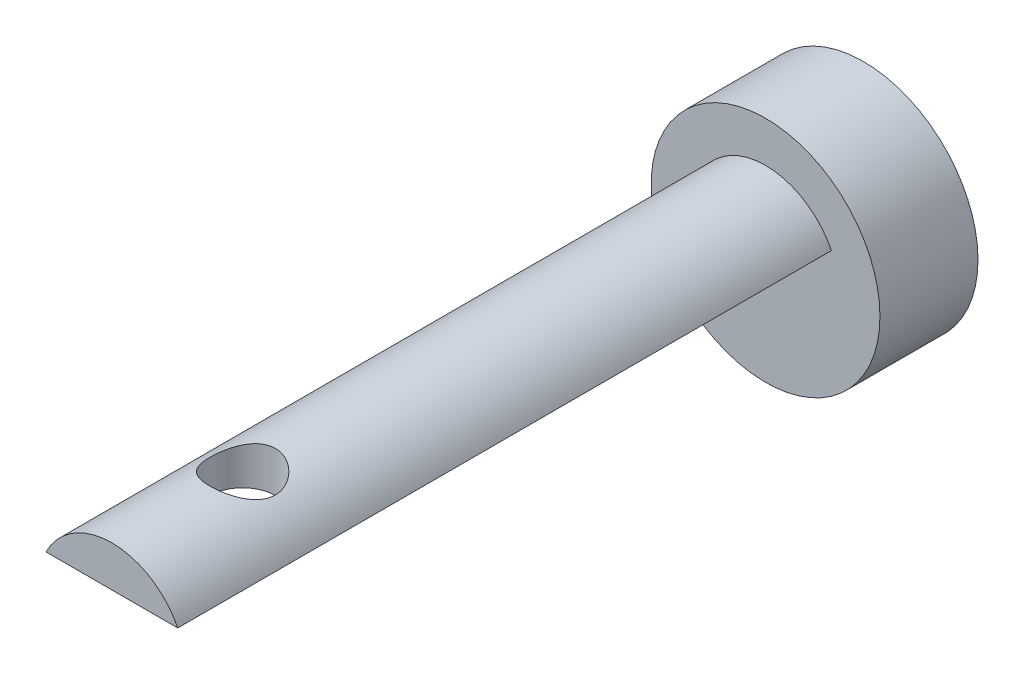
from build123d import *

# Parameters (mm, degrees)
BOSS_EXTRUDE1_DEPTH = 3
BOSS_EXTRUDE2_DEPTH = 20
SKETCH3_R           = 1
CUT_EXTRUDE1_DEPTH  = 10


with BuildPart() as part:
    # Sketch1 → Boss-Extrude1 (new body)
    with BuildSketch(Plane.XY):
        with BuildLine():
            ThreePointArc((3.354101966, 1), (0, 3.5), (-3.354101966, 1))
            Line((-3.354101966, 1), (3.354101966, 1))
        make_face()
        with BuildLine():
            Line((3.354101966, 1), (-3.354101966, 1))
            ThreePointArc((-3.354101966, 1), (-0.505293538, -3.463333429), (3.5, 0))
            ThreePointArc((3.5, 0), (3.463333429, 0.505293538), (3.354101966, 1))
        make_face()
    extrude(amount=BOSS_EXTRUDE1_DEPTH)

    # Sketch2 → Boss-Extrude2 (add)
    with BuildSketch(Plane.XY.offset(3)):
        with BuildLine():
            ThreePointArc((2.015564437, 1), (0, 2.25), (-2.015564437, 1))
            Line((-2.015564437, 1), (2.015564437, 1))
        make_face()
    extrude(amount=BOSS_EXTRUDE2_DEPTH)

    # Sketch3 → Cut-Extrude1 (cut)
    with BuildSketch(Plane(origin=(0, 1, 0), x_dir=(-1, 0, 0), z_dir=(0, -1, 0))):
        with Locations(Location((0, -19, 0), (0, 0, 90))):
            Circle(SKETCH3_R)
    extrude(amount=-CUT_EXTRUDE1_DEPTH, mode=Mode.SUBTRACT)


solid = part.part
